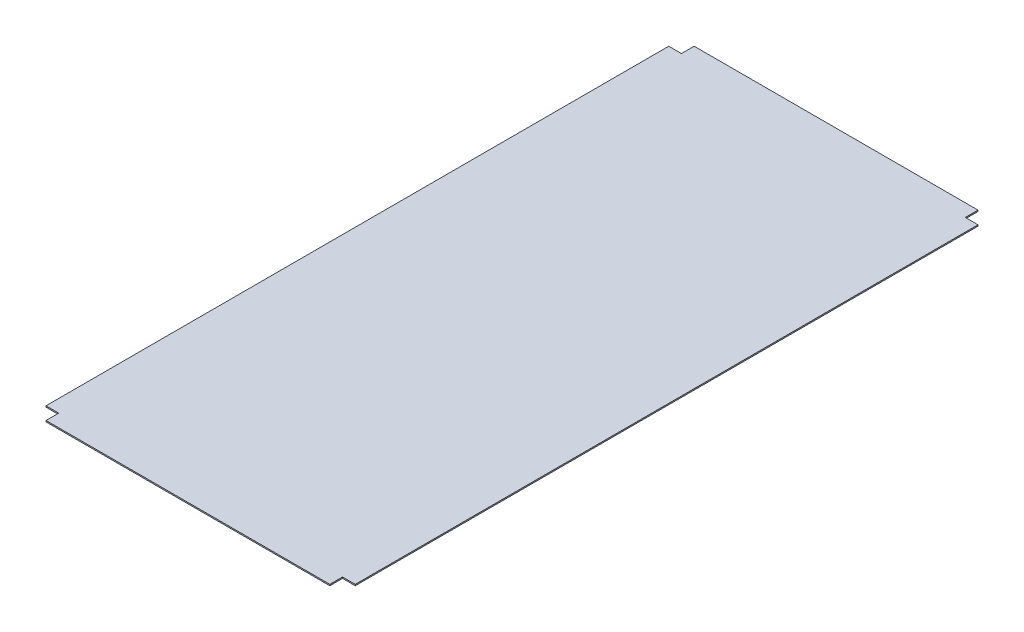
from build123d import *

# Parameters (mm, degrees)
CROQUIS1_W              = 730
CROQUIS1_H              = 1530
SALIENTE_EXTRUIR1_DEPTH = 3
CROQUIS2_W              = 30
CROQUIS2_H              = 30
CORTAR_EXTRUIR1_DEPTH   = 848.619608079


with BuildPart() as part:
    # Croquis1 → Saliente-Extruir1 (new body)
    with BuildSketch(Plane(origin=(0, 0, 0), x_dir=(1, 0, 0), z_dir=(0, 1, 0))):
        Rectangle(CROQUIS1_W, CROQUIS1_H)
    extrude(amount=SALIENTE_EXTRUIR1_DEPTH)

    # Croquis2 → Cortar-Extruir1 (cut, through all)
    with BuildSketch(Plane(origin=(0, 3, 0), x_dir=(1, 0, 0), z_dir=(0, 1, 0))):
        with Locations((-350, 750)):
            Rectangle(CROQUIS2_W, CROQUIS2_H)
        with Locations((350, 750)):
            Rectangle(CROQUIS2_W, CROQUIS2_H)
        with Locations((350, -750)):
            Rectangle(CROQUIS2_W, CROQUIS2_H)
        with Locations((-350, -750)):
            Rectangle(CROQUIS2_W, CROQUIS2_H)
    extrude(amount=-CORTAR_EXTRUIR1_DEPTH, mode=Mode.SUBTRACT)


solid = part.part
